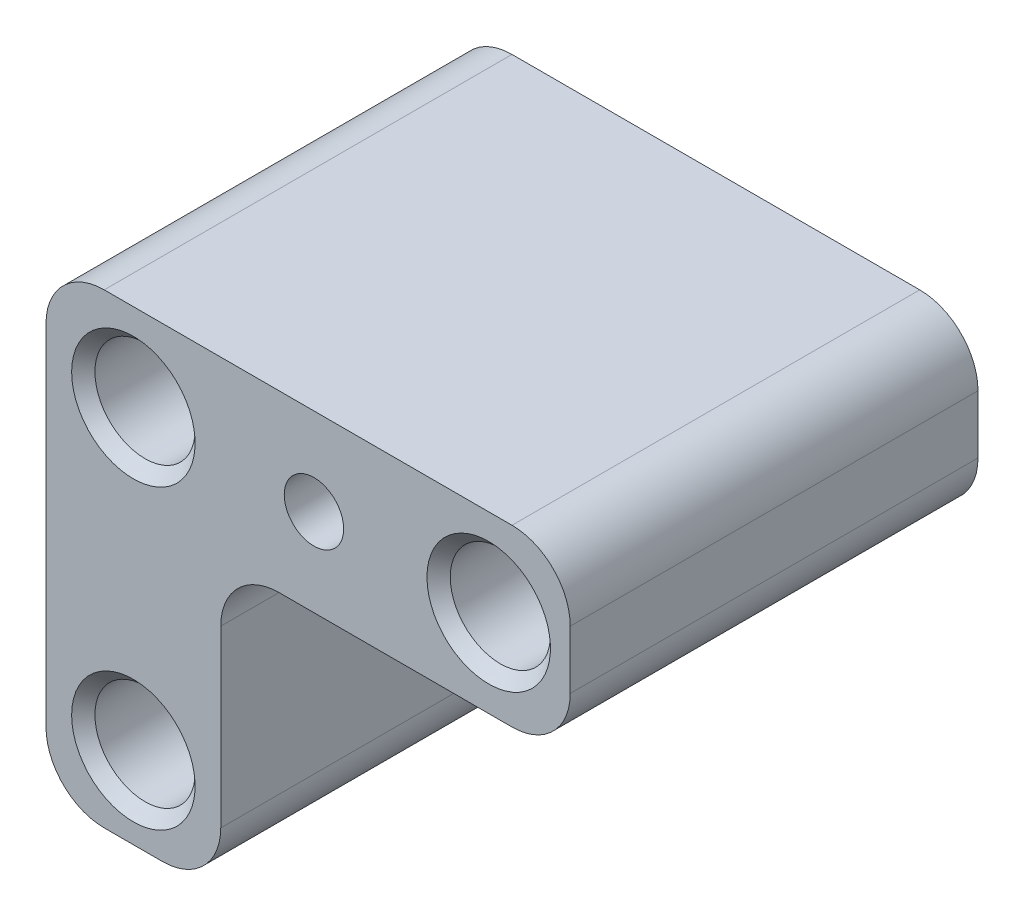
from build123d import *

# Parameters (mm, degrees)
SKETCH2_R           = 2.55
SKETCH2_W           = 30
SKETCH2_H           = 15
BOSS_EXTRUDE1_DEPTH = 35
SKETCH3_R           = 4.3
CUT_EXTRUDE1_DEPTH  = 29.6
SKETCH4_R           = 4.3
CUT_EXTRUDE2_DEPTH  = 29.6
SKETCH5_R           = 2.55
CUT_EXTRUDE3_DEPTH  = 29.6
FILLET1_R           = 5
CHAMFER1_SIZE       = 1


with BuildPart() as part:
    # Sketch2 → Boss-Extrude1 (new body)
    # profile 1 of 2: a face of its own
    with BuildSketch(Plane.XY):
        Polygon((-326.5, 320), (-311.5, 320), (-311.5, 345), (-311.5, 360), (-326.5, 360), align=None)
        with Locations((-319, 327)):
            Circle(SKETCH2_R, mode=Mode.SUBTRACT)
        with Locations((-319, 352.5)):
            Circle(SKETCH2_R, mode=Mode.SUBTRACT)
    # profile 2 of 2: a face of its own
    with BuildSketch(Plane.XY):
        with Locations((-296.5, 352.5)):
            Rectangle(SKETCH2_W, SKETCH2_H)
        with Locations((-288.5, 352.5)):
            Circle(SKETCH2_R, mode=Mode.SUBTRACT)
    extrude(amount=BOSS_EXTRUDE1_DEPTH)

    # Sketch3 → Cut-Extrude1 (cut)
    with BuildSketch(Plane.XY.offset(35)):
        with Locations((-319, 352.5)):
            Circle(SKETCH3_R)
        with Locations((-319, 327)):
            Circle(SKETCH3_R)
        with Locations((-288.5, 352.5)):
            Circle(SKETCH3_R)
    extrude(amount=-CUT_EXTRUDE1_DEPTH, mode=Mode.SUBTRACT)

    # Sketch4 → Cut-Extrude2 (cut)
    with BuildSketch(Plane(origin=(0, 0, 0), x_dir=(-1, 0, 0), z_dir=(0, 0, -1))):
        with Locations((303.5, 352.5)):
            Circle(SKETCH4_R)
    extrude(amount=-CUT_EXTRUDE2_DEPTH, mode=Mode.SUBTRACT)

    # Sketch5 → Cut-Extrude3 (cut)
    with BuildSketch(Plane(origin=(0, 0, 29.6), x_dir=(-1, 0, 0), z_dir=(0, 0, -1))):
        with Locations((303.5, 352.5)):
            Circle(SKETCH5_R)
    extrude(amount=-CUT_EXTRUDE3_DEPTH, mode=Mode.SUBTRACT)

    # Fillet1
    fillet1_edges = [part.edges().sort_by_distance(p)[0] for p in [
        (-311.5, 345, 17.5),
        (-281.5, 345, 17.5),
        (-281.5, 360, 17.5),
        (-311.5, 320, 17.5),
        (-326.5, 320, 17.5),
        (-326.5, 360, 17.5),
    ]]
    fillet(fillet1_edges, radius=FILLET1_R)

    # Chamfer1
    chamfer1_edges = [part.edges().sort_by_distance(p)[0] for p in [
        (-292.8, 352.5, 35),
        (-323.3, 327, 35),
        (-323.3, 352.5, 35),
        (-299.2, 352.5, 0),
    ]]
    chamfer(chamfer1_edges, length=CHAMFER1_SIZE)


solid = part.part
